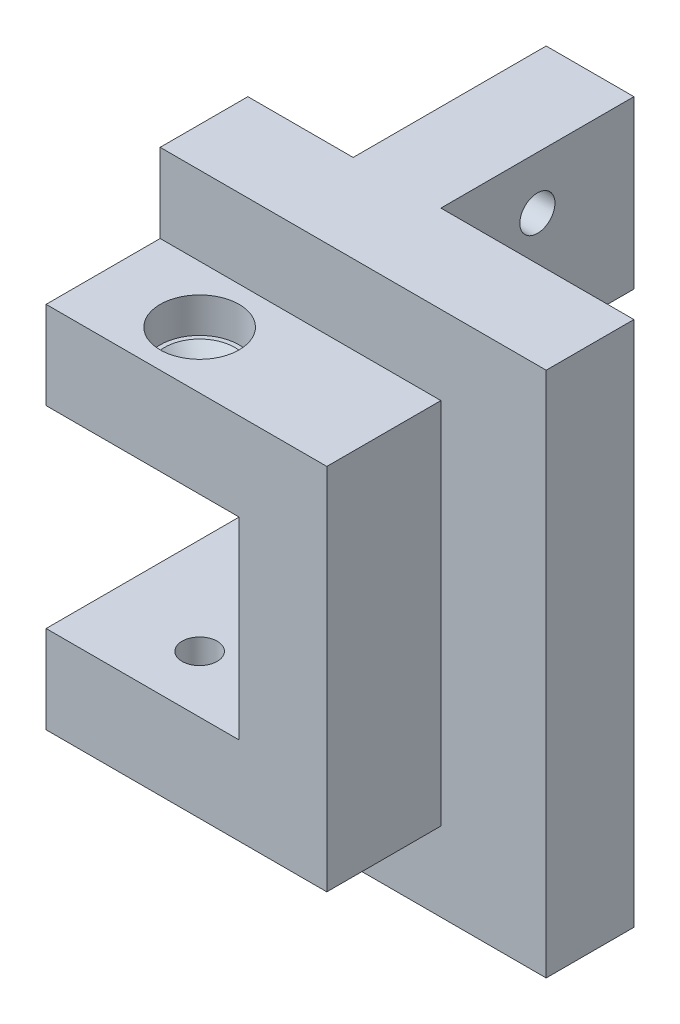
from build123d import *

# Parameters (mm, degrees)
BOSS_EXTRUDE1_DEPTH = 10
BOSS_EXTRUDE2_DEPTH = 32
BOSS_EXTRUDE3_DEPTH = 13
SKETCH4_R           = 2
CUT_EXTRUDE1_DEPTH  = 54.907327888
SKETCH5_R           = 2
CUT_EXTRUDE2_DEPTH  = 50.527769988
SKETCH6_R           = 4.5
CUT_EXTRUDE3_DEPTH  = 4
SKETCH7_R           = 4.5
CUT_EXTRUDE4_DEPTH  = 4
CHAMFER2_SIZE       = 2


with BuildPart() as part:
    # Sketch1 → Boss-Extrude1 (new body)
    with BuildSketch(Plane.XY):
        Polygon((0, 0), (0, -30), (-44, -30), (-44, -11), (-22, -11), (-22, 0), align=None)
    extrude(amount=BOSS_EXTRUDE1_DEPTH)

    # Sketch2 → Boss-Extrude2 (add)
    with BuildSketch(Plane.XY.offset(10)):
        Polygon((-44, -11), (-22, -11), (-22, -30), (-32, -30), (-32, -18), (-44, -18), align=None)
    extrude(amount=-BOSS_EXTRUDE2_DEPTH)

    # Sketch3 → Boss-Extrude3 (add)
    with BuildSketch(Plane.XY.offset(10)):
        Polygon((-44, -11), (-22, -11), (-22, 0), (-12, 0), (-12, -21), (-44, -21), align=None)
    extrude(amount=BOSS_EXTRUDE3_DEPTH)

    # Sketch4 → Cut-Extrude1 (cut, through all)
    with BuildSketch(Plane.XZ.offset(21)):
        with Locations(Location((-33, 16.5, 0), (0, 0, 270))):
            Circle(SKETCH4_R)
    extrude(amount=-CUT_EXTRUDE1_DEPTH, mode=Mode.SUBTRACT)

    # Sketch5 → Cut-Extrude2 (cut, through all)
    with BuildSketch(Plane.ZY.offset(32)):
        with Locations((-11, -24)):
            Circle(SKETCH5_R)
    extrude(amount=-CUT_EXTRUDE2_DEPTH, mode=Mode.SUBTRACT)

    # Sketch6 → Cut-Extrude3 (cut)
    with BuildSketch(Plane.ZY.offset(32)):
        with Locations((-11, -24)):
            Circle(SKETCH6_R)
    extrude(amount=-CUT_EXTRUDE3_DEPTH, mode=Mode.SUBTRACT)

    # Sketch7 → Cut-Extrude4 (cut)
    with BuildSketch(Plane.XZ.offset(21)):
        with Locations(Location((-33, 16.5, 0), (0, 0, 270))):
            Circle(SKETCH7_R)
    extrude(amount=-CUT_EXTRUDE4_DEPTH, mode=Mode.SUBTRACT)

    # Chamfer2
    chamfer2_edges = [part.edges().sort_by_distance(p)[0] for p in [
        (-28, -24, -13),
        (-33, -17, 18.5),
    ]]
    chamfer(chamfer2_edges, length=CHAMFER2_SIZE)

    # Mirror1: part across plane


with BuildPart() as part_1:
    add(part.part)
    add(part.part.mirror(Plane(origin=(0, 0, 10), x_dir=(0, 0, 1), z_dir=(0, -1, 0))))


solid = part_1.part
